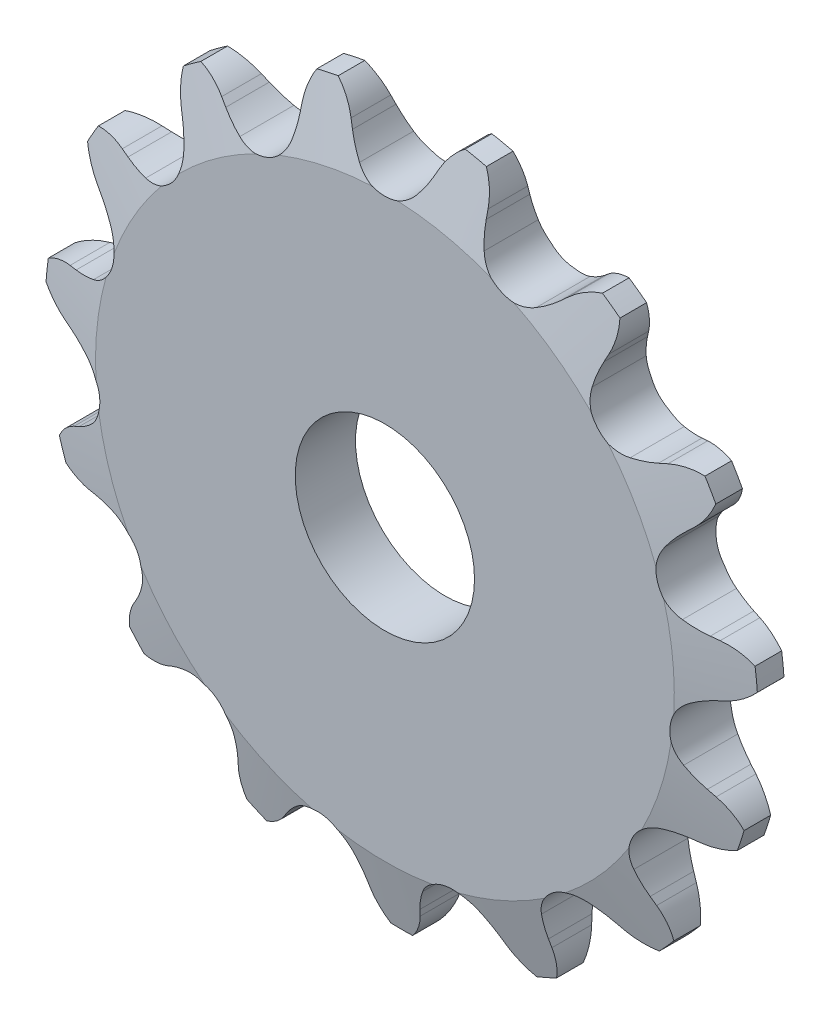
from build123d import *

# Parameters (mm, degrees)
CUT_EXTRUDE1_DEPTH      = 36.791353611
CIRPATTERN1_COUNT       = 15
CUT_EXTRUDE2_DEPTH      = 36.742160228
CUT_EXTRUDE2_DEPTH_BACK = 36.742160228
SKETCH3_OUTSIDE_W       = 66.628
SKETCH3_OUTSIDE_H       = 66.362
SKETCH3_OUTSIDE_R       = 25.273
SKETCH3_OUTSIDE_R_2     = 6.35


with BuildPart() as part:
    # Sketch1 → Revolve1 (revolve)
    with BuildSketch(Plane(origin=(0, 0, 0), x_dir=(0, 0, -1), z_dir=(1, 0, 0)), mode=Mode.PRIVATE) as revolve1_sk:
        Polygon((2.1336, 0), (-2.1336, 0), (-2.1336, 20.500800896), (-0.942975, 25.263300896), (0.942975, 25.263300896), (2.1336, 20.500800896), align=None)
    revolve(revolve1_sk.sketch.rotate(Axis((0, 0, -2.1336), (0, 0, 1)), 90), axis=Axis((0, 0, -2.1336), (0, 0, 1)))

    # Sketch0 → Cut-Extrude1 (cut, symmetric)
    with BuildSketch(Plane.XY):
        with BuildLine():
            Line((7.876845215, -22.037606674), (7.538283816, -21.58394277))
            ThreePointArc((7.538283816, -21.58394277), (7.002749236, -20.952462067), (6.392943269, -20.392371139))
            ThreePointArc((6.392943269, -20.392371139), (4.223842391, -19.871616092), (2.454080297, -21.22960231))
            ThreePointArc((2.454080297, -21.22960231), (2.12480433, -21.989301265), (1.892415488, -22.784009129))
            Line((1.892415488, -22.784009129), (1.767645993, -23.336157055))
            ThreePointArc((1.767645993, -23.336157055), (0.110022884, -25.836136287), (-2.78970089, -26.603738115))
            ThreePointArc((-2.78970089, -26.603738115), (5.561555391, -26.165060947), (13.36923371, -23.169050536))
            ThreePointArc((13.36923371, -23.169050536), (10.407992437, -23.647235287), (7.876845215, -22.037606674))
        make_face()
    cut_extrude1 = extrude(amount=CUT_EXTRUDE1_DEPTH, both=True, mode=Mode.SUBTRACT)

    # CirPattern1: Cut-Extrude1 ×15 about axis
    cirpattern1_axis = Axis((0, 0, 0), (0, 0, 1))
    for i in range(1, CIRPATTERN1_COUNT):
        add(cut_extrude1.rotate(cirpattern1_axis, i * 360 / CIRPATTERN1_COUNT), mode=Mode.SUBTRACT)

    # Sketch3 outside → Cut-Extrude2 (cut, two sides: drawn at the far end of the back side and taken through both)
    # profile 1 of 2: a face of its own
    with BuildSketch(Plane.XY.offset(-CUT_EXTRUDE2_DEPTH_BACK)):
        with Locations((0, -0.202)):
            Rectangle(SKETCH3_OUTSIDE_W, SKETCH3_OUTSIDE_H)
        Circle(SKETCH3_OUTSIDE_R, mode=Mode.SUBTRACT)
    # profile 2 of 2: a face of its own
    with BuildSketch(Plane.XY.offset(-CUT_EXTRUDE2_DEPTH_BACK)):
        Circle(SKETCH3_OUTSIDE_R_2)
    extrude(amount=CUT_EXTRUDE2_DEPTH + CUT_EXTRUDE2_DEPTH_BACK, mode=Mode.SUBTRACT)


solid = part.part
